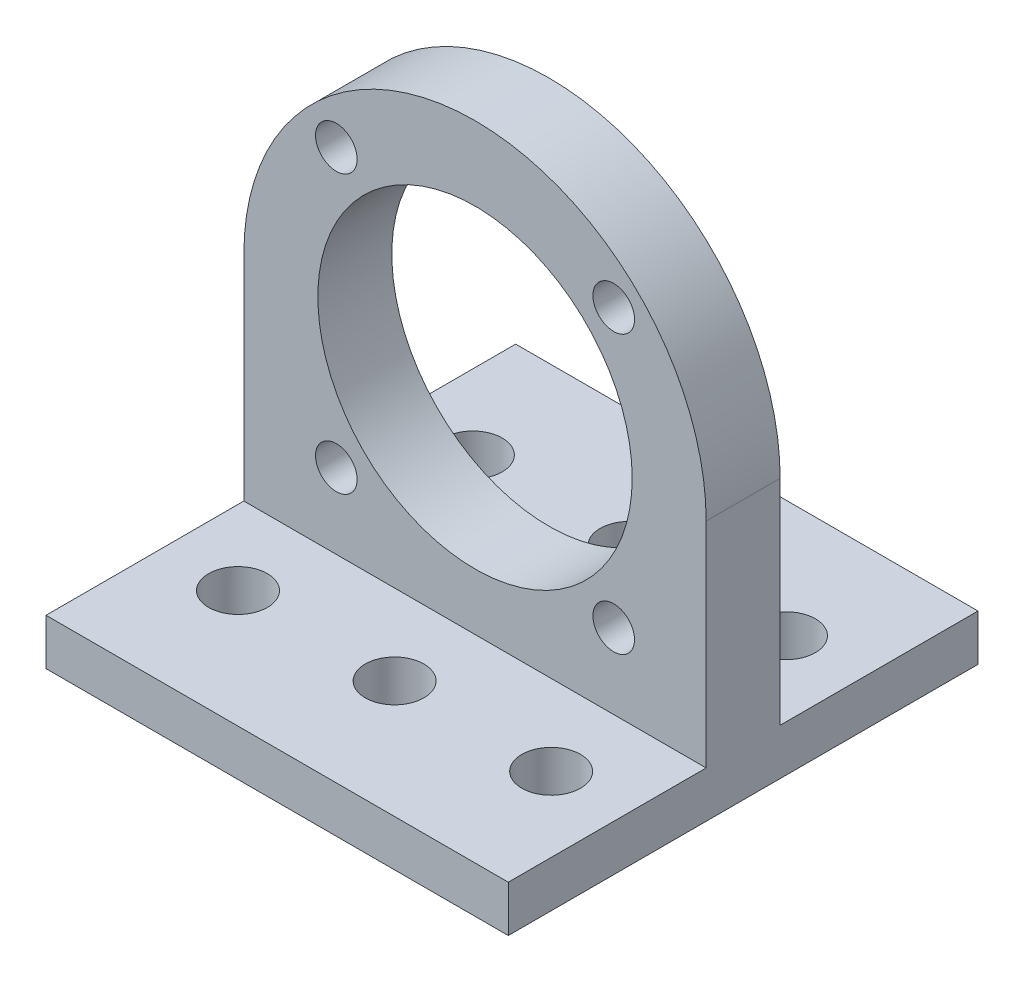
from build123d import *

# Parameters (mm, degrees)
SKETCH1_R        = 17
EXTRUSION1_DEPTH = 8
SKETCH2_W        = 50
SKETCH2_H        = 50.8
EXTRUSION2_DEPTH = 5
HOLE2_D          = 6.35
HOLE3_D          = 4.5


with BuildPart() as part:
    # Sketch1 → Extrusion1 (new body)
    with BuildSketch(Plane.XY):
        with BuildLine():
            Line((25, -23.1305), (25, 0))
            ThreePointArc((25, 0), (0, 25), (-25, 0))
            Line((-25, 0), (-25, -23.1305))
            Line((-25, -23.1305), (25, -23.1305))
        make_face()
        Circle(SKETCH1_R, mode=Mode.SUBTRACT)
    extrude(amount=EXTRUSION1_DEPTH)

    # Sketch2 → Extrusion2 (add)
    with BuildSketch(Plane.XZ.offset(23.1305)):
        with Locations((0, 4)):
            Rectangle(SKETCH2_W, SKETCH2_H)
    extrude(amount=EXTRUSION2_DEPTH)

    # Hole2 (through all)
    with Locations(Plane(origin=(0, -28.1305, 0), x_dir=(-1, 0, 0), z_dir=(0, -1, 0))):
        with Locations((16.933333333, -16.7), (0, -16.7), (16.933333333, 8.7), (0, 8.7), (-16.933333333, -16.7), (-16.933333333, 8.7)):
            Hole(HOLE2_D / 2)

    # Hole3 (through all)
    with Locations(Plane(origin=(0, 0, 0), x_dir=(-1, 0, 0), z_dir=(0, 0, -1))):
        with Locations((-15, 15), (15, 15), (-15, -15), (15, -15)):
            Hole(HOLE3_D / 2)


solid = part.part
